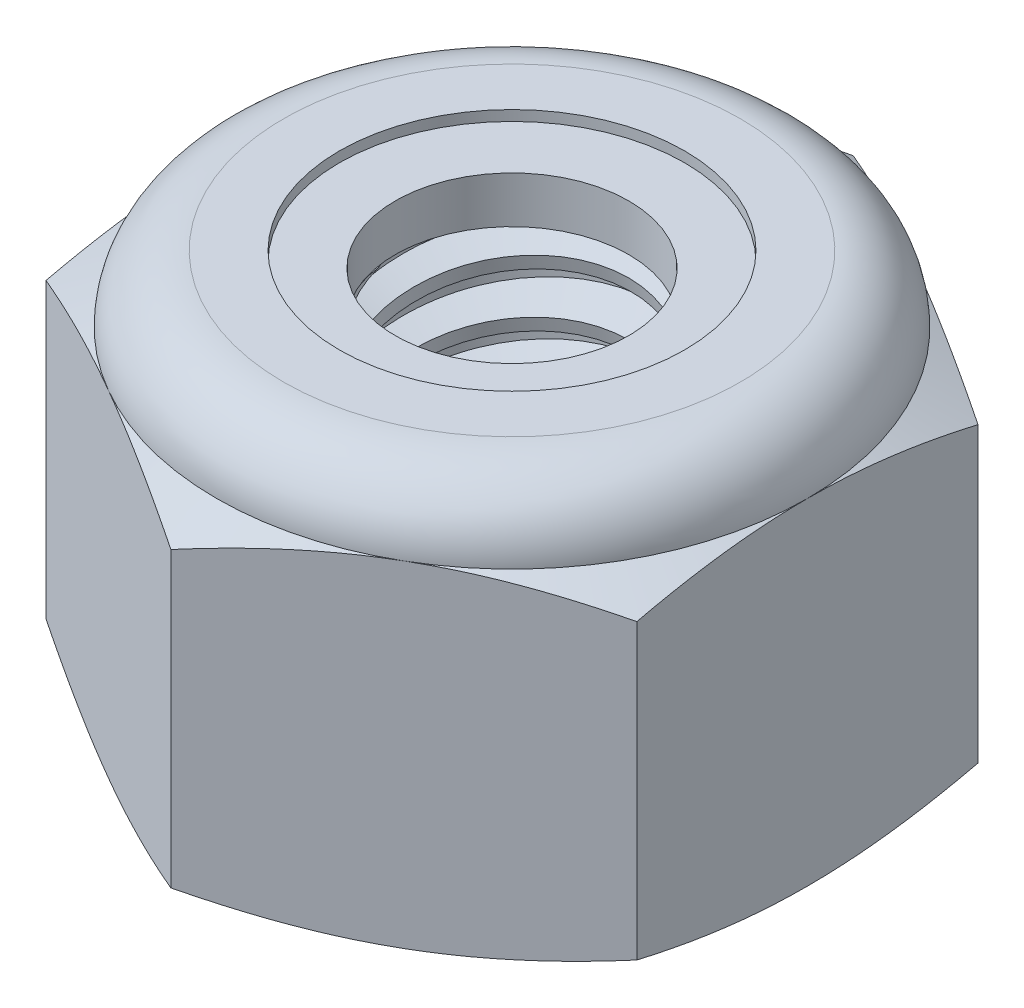
from build123d import *

# Parameters (mm, degrees)
EXTRUDE1_DEPTH      = 5.953125
SKETCH2_W           = 2.0828
SKETCH2_H           = 5.953125
LPATTERN1_COUNT     = 8
LPATTERN1_PITCH     = 0.79375
LPATTERN1_COL_COUNT = 2
LPATTERN1_COL_PITCH = 0.79375


with BuildPart() as part:
    # Sketch1 → Extrude1 (new body)
    with BuildSketch(Plane(origin=(0, 0, 0), x_dir=(1, 0, 0), z_dir=(0, 1, 0))):
        Polygon((0, 5.040989538), (-4.365625, 2.520494769), (-4.365625, -2.520494769), (0, -5.040989538), (4.365625, -2.520494769), (4.365625, 2.520494769), align=None)
    extrude(amount=EXTRUDE1_DEPTH)

    # Sketch4 → Cut-Revolve2 (revolve, cut)
    with BuildSketch(Plane(origin=(0, 0, 0), x_dir=(0, 0, -1), z_dir=(1, 0, 0)), mode=Mode.PRIVATE) as cut_revolve2_sk:
        Polygon((0, 5.953125), (2.0828, 5.953125), (1.725765218, 5.786636947), (1.725765218, 0.166488053), (2.0828, 0), (0, 0), align=None)
    revolve(cut_revolve2_sk.sketch.rotate(Axis((0, 5.953125, 0), (0, 1, 0)), 54.618153421), axis=Axis((0, 5.953125, 0), (0, 1, 0)), mode=Mode.SUBTRACT)


with BuildPart() as body_2:
    # Sketch2 → Revolve1 (revolve)
    with BuildSketch(Plane(origin=(0, 0, 0), x_dir=(0, 0, -1), z_dir=(1, 0, 0))):
        with Locations((1.0414, 2.9765625)):
            Rectangle(SKETCH2_W, SKETCH2_H)
    revolve(axis=Axis((0, -2.0828, 0), (0, 1, 0)))

    # Sketch3 → Cut-Revolve1 (revolve, cut)
    with BuildSketch(Plane(origin=(0, 0, 0), x_dir=(0, 0, -1), z_dir=(1, 0, 0)), mode=Mode.PRIVATE) as cut_revolve1_sk:
        Polygon((2.101371857, 5.855659896), (2.231374854, 5.173404168), (1.762908932, 5.33664843), (1.725765218, 5.531578638), align=None)
    cut_revolve1 = revolve(cut_revolve1_sk.sketch.rotate(Axis((0, 5.953125, 0.162231854), (0, -0.9823254572523517, -0.1871809179215615)), 180), axis=Axis((0, 5.953125, 0.162231854), (0, -0.9823254572523517, -0.1871809179215615)), mode=Mode.SUBTRACT)

    # LPattern1: Cut-Revolve1 ×8
    with Locations(*[(0, -i * LPATTERN1_PITCH, 0) for i in range(1, LPATTERN1_COUNT)]):
        add(cut_revolve1, mode=Mode.SUBTRACT)

    # LPattern1 col: Cut-Revolve1 ×2
    with Locations(*[(0, i * LPATTERN1_COL_PITCH, 0) for i in range(1, LPATTERN1_COL_COUNT)]):
        add(cut_revolve1, mode=Mode.SUBTRACT)


with BuildPart() as part_1:
    add(part.part)

    # Combine1: cut body 2
    add(body_2.part, mode=Mode.SUBTRACT)

    # Sketch5 → Cut-Revolve3 (revolve, cut)
    with BuildSketch(Plane(origin=(0, 0, 0), x_dir=(0, 0, -1), z_dir=(1, 0, 0)), mode=Mode.PRIVATE) as cut_revolve3_sk:
        with BuildLine():
            Line((0, 0), (4.365625, 0))
            Line((4.365625, 0), (5.040989538, 0.314927656))
            Line((5.040989538, 0.314927656), (5.040989538, 4.646009844))
            Line((5.040989538, 4.646009844), (4.365625, 4.9609375))
            ThreePointArc((4.365625, 4.9609375), (4.075020009, 5.662520009), (3.3734375, 5.953125))
            Line((3.3734375, 5.953125), (3.3734375, 7.223125))
            Line((3.3734375, 7.223125), (6.310989538, 7.223125))
            Line((6.310989538, 7.223125), (6.310989538, -1.27))
            Line((6.310989538, -1.27), (0, -1.27))
            Line((0, -1.27), (0, 0))
        make_face()
    revolve(cut_revolve3_sk.sketch.rotate(Axis((0, 0, 0), (0, 1, 0)), 54.618153421), axis=Axis((0, 0, 0), (0, 1, 0)), mode=Mode.SUBTRACT)

    # Sketch6 → Cut-Revolve4 (revolve, cut)
    with BuildSketch(Plane(origin=(0, 0, 0), x_dir=(0, 0, -1), z_dir=(1, 0, 0)), mode=Mode.PRIVATE) as cut_revolve4_sk:
        with BuildLine():
            Line((0, 4.9609375), (4.213225, 4.9609375))
            ThreePointArc((4.213225, 4.9609375), (3.967256936, 5.554756936), (3.3734375, 5.800725))
            Line((3.3734375, 5.800725), (2.549601359, 5.800725))
            Line((2.549601359, 5.800725), (2.549601359, 7.223125))
            Line((2.549601359, 7.223125), (0, 7.223125))
            Line((0, 7.223125), (0, 4.9609375))
        make_face()
    revolve(cut_revolve4_sk.sketch.rotate(Axis((0, 7.223125, 0), (0, 1, 0)), 54.618153421), axis=Axis((0, 7.223125, 0), (0, 1, 0)), mode=Mode.SUBTRACT)


with BuildPart() as body_2_2:
    # Sketch7 → Revolve2 (revolve)
    with BuildSketch(Plane(origin=(0, 0, 0), x_dir=(0, 0, -1), z_dir=(1, 0, 0))):
        with BuildLine():
            Line((1.725765218, 5.0371375), (4.133213408, 5.0371375))
            ThreePointArc((4.133213408, 5.0371375), (3.885726726, 5.527175629), (3.3734375, 5.724525))
            Line((3.3734375, 5.724525), (1.725765218, 5.724525))
            Line((1.725765218, 5.724525), (1.725765218, 5.0371375))
        make_face()
    revolve(axis=Axis((0, 5.0371375, 0), (0, 1, 0)))


solid = Compound([part_1.part, body_2_2.part])
